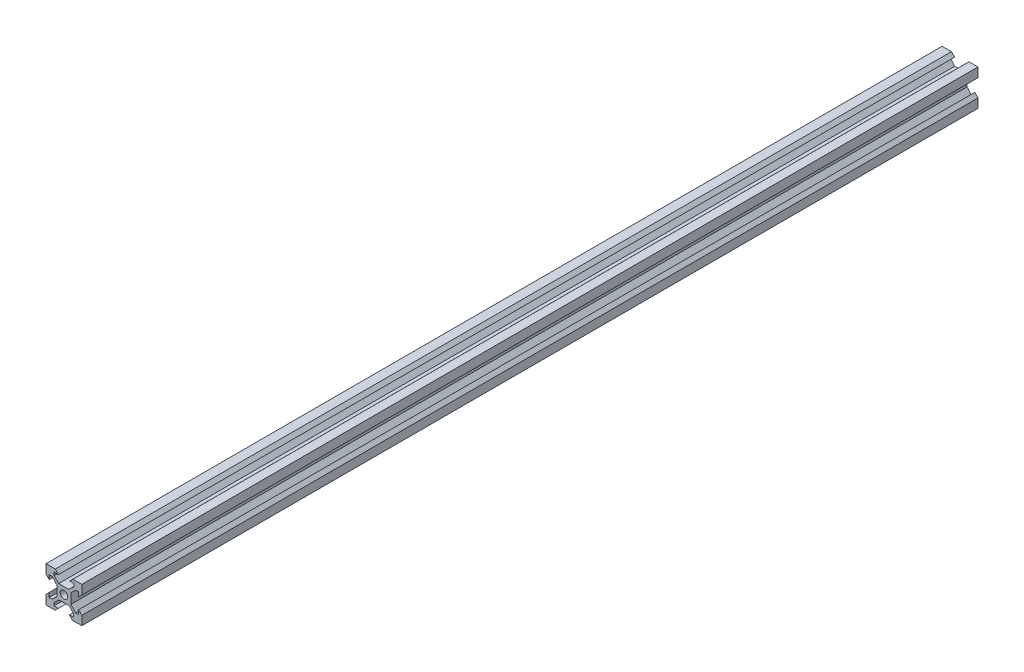
from build123d import *

# Parameters (mm, degrees)
SZKIC1_R                    = 2.1
DODANIE_WYCI_GNI_CIE1_DEPTH = 500


with BuildPart() as part:
    # Szkic1 → Dodanie-wyciągnięcie1 (new body)
    with BuildSketch(Plane.XY):
        Polygon((7.039765266, 13.885512537), (12.719765266, 13.885512537), (15.569105371, 16.538765319), (15.569105371, 18.199594156), (13.169105371, 18.199594156), (15, 20), (20, 20), (20, 14.801319399), (18.199594156, 13.030894629), (18.199594156, 15.430894629), (16.538765319, 15.430894629), (13.885512537, 12.960234734), (13.885512537, 7.280234734), (16.538765319, 4.430894629), (18.199594156, 4.430894629), (18.199594156, 6.830894629), (20, 5), (20, 0), (14.801319399, 0), (13.030894629, 1.800405844), (15.430894629, 1.800405844), (15.430894629, 3.461234681), (12.960234734, 6.114487463), (7.280234734, 6.114487463), (4.430894629, 3.461234681), (4.430894629, 1.800405844), (6.830894629, 1.800405844), (5, 0), (0, 0), (0, 5.198680601), (1.800405844, 6.969105371), (1.800405844, 4.569105371), (3.461234681, 4.569105371), (6.114487463, 7.039765266), (6.114487463, 12.719765266), (3.461234681, 15.569105371), (1.800405844, 15.569105371), (1.800405844, 13.169105371), (0, 15), (0, 20), (5.198680601, 20), (6.969105371, 18.199594156), (4.569105371, 18.199594156), (4.569105371, 16.538765319), align=None)
        with Locations((10, 10)):
            Circle(SZKIC1_R, mode=Mode.SUBTRACT)
    extrude(amount=DODANIE_WYCI_GNI_CIE1_DEPTH)


solid = part.part
